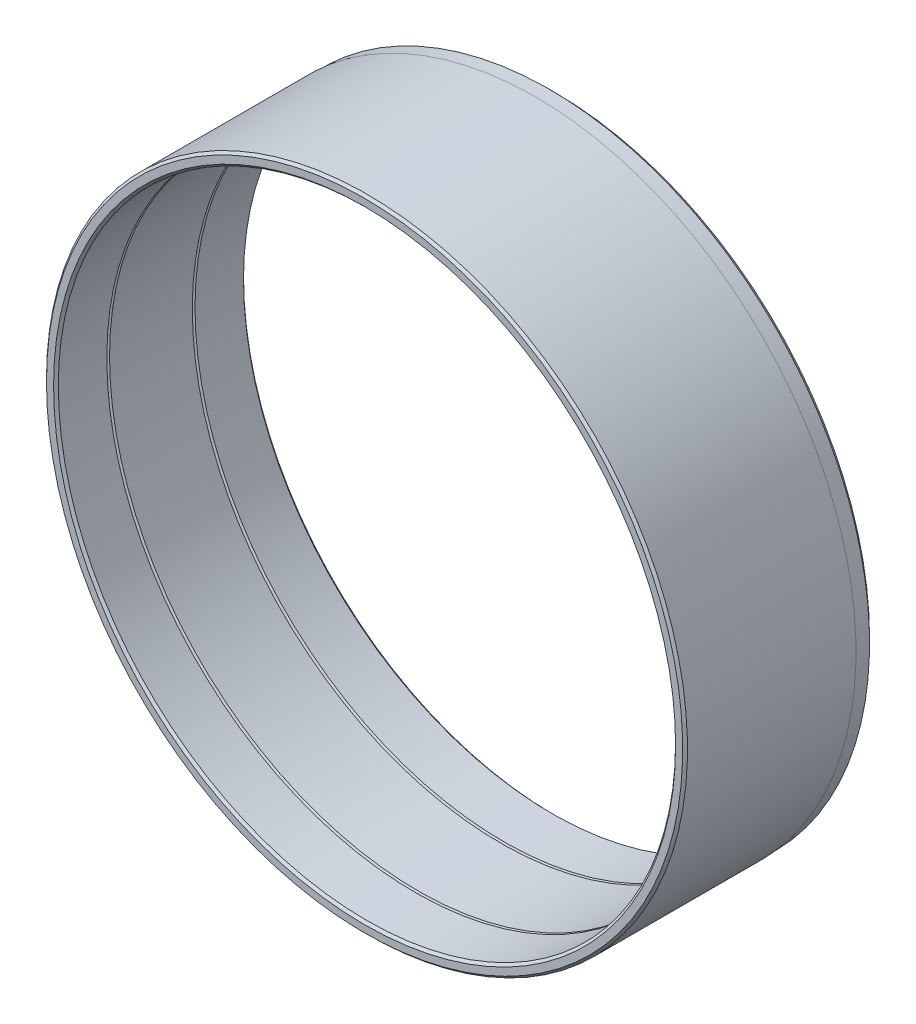
from build123d import *

# Parameters (mm, degrees)
CHAMFER1_SIZE = 0.5


with BuildPart() as part:
    # Sketch1 → Revolve1 (revolve)
    with BuildSketch(Plane(origin=(0, 0, 0), x_dir=(0, 0, -1), z_dir=(1, 0, 0)), mode=Mode.PRIVATE) as revolve1_sk:
        Polygon((0, 0), (-40, 0), (-40, 67), (-39.5, 67.5), (-4, 67.5), (-4, 67.35), (-1, 67.35), (0, 66.35), align=None)
    revolve(revolve1_sk.sketch.rotate(Axis((0, 0, 0), (0, 0, 1)), 90), axis=Axis((0, 0, 0), (0, 0, 1)))

    # Sketch2 → Cut-Revolve1 (revolve, cut)
    with BuildSketch(Plane(origin=(0, 0, 0), x_dir=(0, 0, -1), z_dir=(1, 0, 0)), mode=Mode.PRIVATE) as cut_revolve1_sk:
        Polygon((0, 0), (-40, 0), (-40, 65), (-29.288675135, 65), (-29, 65.5), (-28.711324865, 65), (-11.288675135, 65), (-11, 65.5), (-10.711324865, 65), (0, 65), align=None)
    revolve(cut_revolve1_sk.sketch.rotate(Axis((0, 0, 0), (0, 0, 1)), 90), axis=Axis((0, 0, 0), (0, 0, 1)), mode=Mode.SUBTRACT)

    # Chamfer1
    chamfer1_edges = [part.edges().sort_by_distance(p)[0] for p in [
        (65, 0, 0),
        (65, 0, 40),
    ]]
    chamfer(chamfer1_edges, length=CHAMFER1_SIZE)


solid = part.part
